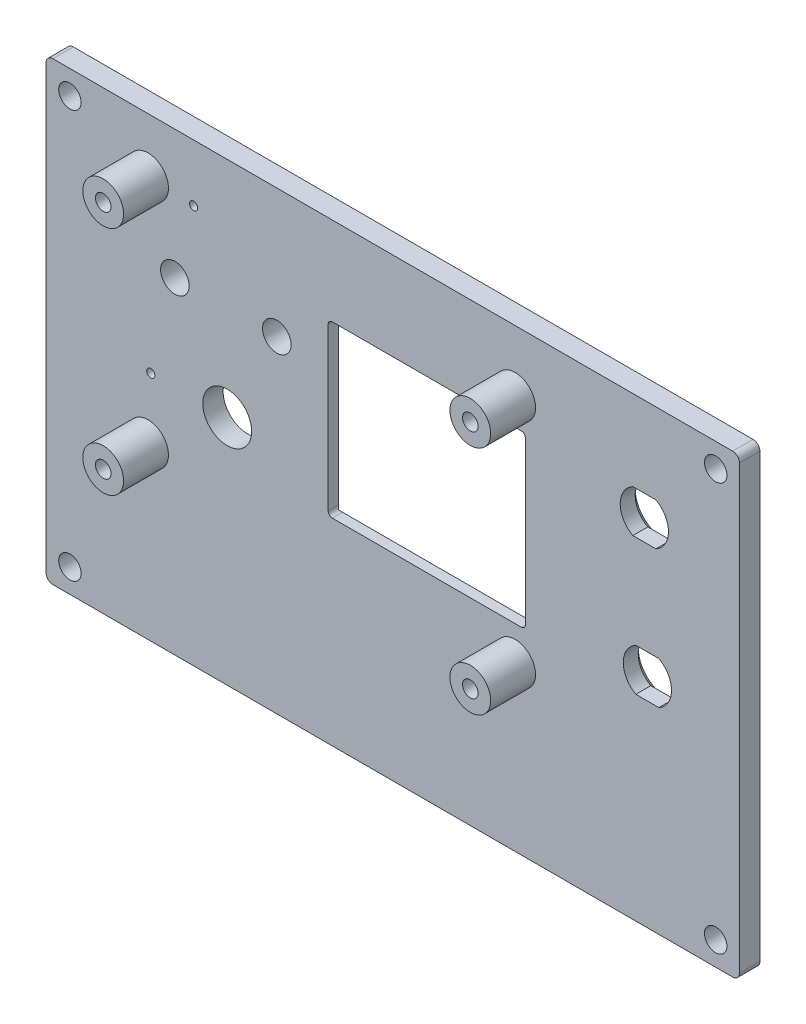
from build123d import *

# Parameters (mm, degrees)
SKETCH_1_W          = 102
SKETCH_1_H          = 67
EXTRUDE_1_DEPTH     = 3
FILLET_1_R          = 1
SKETCH_2_R          = 3
SKETCH_2_R_2        = 1.15
EXTRUDE_2_DEPTH     = 6.6
SKETCH_3_R          = 3.6
SKETCH_3_R_2        = 2.1
SKETCH_3_R_3        = 0.6
SKETCH_3_W          = 29
SKETCH_3_H          = 25
CUT_EXTRUDE_1_DEPTH = 123.215220001
CHAMFER_1_SIZE      = 1.5
CHAMFER_2_SIZE      = 0.8
SKETCH_4_R          = 1.65
CUT_EXTRUDE_2_DEPTH = 123.413888101
FILLET_2_R          = 0.6


with BuildPart() as part:
    # 草图1 → 凸台-拉伸1 (new body)
    with BuildSketch(Plane.XY):
        with Locations((51, 33.5)):
            Rectangle(SKETCH_1_W, SKETCH_1_H)
    extrude(amount=EXTRUDE_1_DEPTH)

    # 圆角1
    fillet_1_edges = [part.edges().sort_by_distance(p)[0] for p in [
        (0, 67, 1.5),
        (102, 67, 1.5),
        (102, 0, 1.5),
        (0, 0, 1.5),
    ]]
    fillet(fillet_1_edges, radius=FILLET_1_R)

    # 草图2 → 凸台-拉伸2 (add)
    # profile 1 of 4: a face of its own
    with BuildSketch(Plane.XY.offset(3)):
        with Locations(Location((15, 59, 0), (0, 0, 180))):
            Circle(SKETCH_2_R)
        with Locations((15, 59)):
            Circle(SKETCH_2_R_2, mode=Mode.SUBTRACT)
    # profile 2 of 4: a face of its own
    with BuildSketch(Plane.XY.offset(3)):
        with Locations(Location((15, 25, 0), (0, 0, 180))):
            Circle(SKETCH_2_R)
        with Locations((15, 25)):
            Circle(SKETCH_2_R_2, mode=Mode.SUBTRACT)
    # profile 3 of 4: a face of its own
    with BuildSketch(Plane.XY.offset(3)):
        with Locations(Location((69, 24.024333843, 0), (0, 0, 180))):
            Circle(SKETCH_2_R)
        with Locations((69, 24.024333843)):
            Circle(SKETCH_2_R_2, mode=Mode.SUBTRACT)
    # profile 4 of 4: a face of its own
    with BuildSketch(Plane.XY.offset(3)):
        with Locations(Location((69, 58.024333843, 0), (0, 0, 180))):
            Circle(SKETCH_2_R)
        with Locations((69, 58.024333843)):
            Circle(SKETCH_2_R_2, mode=Mode.SUBTRACT)
    extrude(amount=EXTRUDE_2_DEPTH)

    # 草图3 → 切除-拉伸1 (cut, through all)
    with BuildSketch(Plane.XY.offset(3)):
        with Locations((26.64, 34.12)):
            Circle(SKETCH_3_R)
        with Locations((18.94, 48.06)):
            Circle(SKETCH_3_R_2)
        with Locations((33.94, 48.06)):
            Circle(SKETCH_3_R_2)
        with Locations((21.7, 58.6)):
            Circle(SKETCH_3_R_3)
        with Locations((15.4, 34.13)):
            Circle(SKETCH_3_R_3)
        with BuildLine():
            Line((86.757305392, 35.144333843), (90.144398541, 35.144333843))
            ThreePointArc((90.144398541, 35.144333843), (92.000851967, 32.024333843), (90.144398541, 28.904333843))
            Line((90.144398541, 28.904333843), (86.757305392, 28.904333843))
            ThreePointArc((86.757305392, 28.904333843), (84.900851967, 32.024333843), (86.757305392, 35.144333843))
        make_face()
        with Locations((56, 41.524333843)):
            Rectangle(SKETCH_3_W, SKETCH_3_H)
        with BuildLine():
            Line((86.306453426, 55.144333843), (89.693546574, 55.144333843))
            ThreePointArc((89.693546574, 55.144333843), (91.55, 52.024333843), (89.693546574, 48.904333843))
            Line((89.693546574, 48.904333843), (86.306453426, 48.904333843))
            ThreePointArc((86.306453426, 48.904333843), (84.45, 52.024333843), (86.306453426, 55.144333843))
        make_face()
    extrude(amount=-CUT_EXTRUDE_1_DEPTH, mode=Mode.SUBTRACT)

    # 倒角1
    chamfer_1_edges = [part.edges().sort_by_distance(p)[0] for p in [
        (41.5, 41.524333843, 0),
        (56, 54.024333843, 0),
        (70.5, 41.524333843, 0),
        (56, 29.024333843, 0),
    ]]
    chamfer(chamfer_1_edges, length=CHAMFER_1_SIZE)

    # 倒角2
    chamfer_2_edges = [part.edges().sort_by_distance(p)[0] for p in [
        (84.45, 52.024333843, 0),
        (88, 55.144333843, 0),
        (91.55, 52.024333843, 0),
        (88, 48.904333843, 0),
        (84.900851967, 32.024333843, 0),
        (88.450851967, 35.144333843, 0),
        (92.000851967, 32.024333843, 0),
        (88.450851967, 28.904333843, 0),
    ]]
    chamfer(chamfer_2_edges, length=CHAMFER_2_SIZE)

    # 草图4 → 切除-拉伸2 (cut, through all)
    with BuildSketch(Plane(origin=(0, 0, 0), x_dir=(-1, 0, 0), z_dir=(0, 0, -1))):
        with Locations((-98.5, 63.5)):
            Circle(SKETCH_4_R)
        with Locations((-3.5, 63.5)):
            Circle(SKETCH_4_R)
        with Locations((-3.5, 3.5)):
            Circle(SKETCH_4_R)
        with Locations((-98.5, 3.5)):
            Circle(SKETCH_4_R)
    extrude(amount=-CUT_EXTRUDE_2_DEPTH, mode=Mode.SUBTRACT)

    # 圆角2
    fillet_2_edges = [part.edges().sort_by_distance(p)[0] for p in [
        (70.5, 54.024333843, 2.25),
        (70.5, 29.024333843, 2.25),
        (41.5, 29.024333843, 2.25),
        (41.5, 54.024333843, 2.25),
    ]]
    fillet(fillet_2_edges, radius=FILLET_2_R)


solid = part.part
